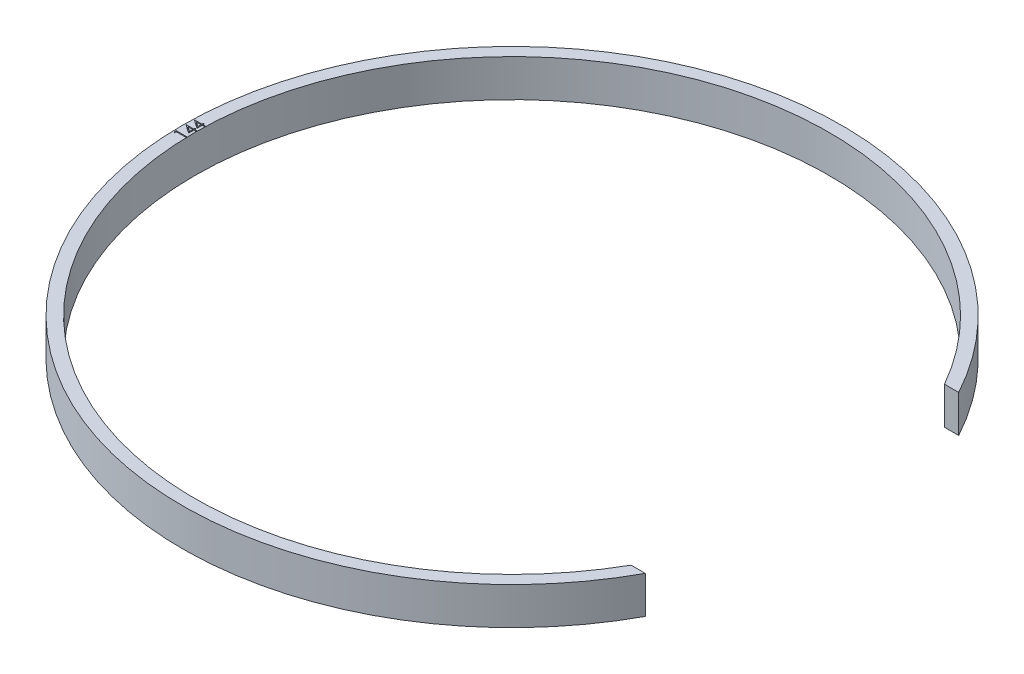
from build123d import *

# Parameters (mm, degrees)
SKETCH1_R           = 53
SKETCH1_R_2         = 51
BOSS_EXTRUDE2_DEPTH = 6
CUT_EXTRUDE1_DEPTH  = 10
CUT_EXTRUDE2_DEPTH  = 0.5


with BuildPart() as part:
    # Sketch1 → Boss-Extrude2 (new body)
    with BuildSketch(Plane(origin=(0, 0, 0), x_dir=(1, 0, 0), z_dir=(0, 1, 0))):
        with Locations(Location((0, 0, 0), (0, 0, 270))):
            Circle(SKETCH1_R)
        with Locations(Location((0, 0, 0), (0, 0, 270))):
            Circle(SKETCH1_R_2, mode=Mode.SUBTRACT)
    extrude(amount=BOSS_EXTRUDE2_DEPTH)

    # Sketch2 → Cut-Extrude1 (cut)
    with BuildSketch(Plane(origin=(0, 6, 0), x_dir=(1, 0, 0), z_dir=(0, 1, 0))):
        Polygon((0, 0), (0, 25.2), (76.826427625, 25.2), (76.826427625, -25.2), (0, -25.2), align=None)
    extrude(amount=-CUT_EXTRUDE1_DEPTH, mode=Mode.SUBTRACT)

    # Sketch3 → Cut-Extrude2 (cut)
    # profile 1 of 3: a face of its own
    with BuildSketch(Plane(origin=(0, 6, 0), x_dir=(1, 0, 0), z_dir=(0, 1, 0))):
        Polygon((-52.794871795, 1.695663061), (-52.794871795, 1.727564103), (-51.583333333, 1.727564103), (-51.583333333, 1.929487179), (-51.403846154, 1.929487179), (-51.403846154, 1.727564103), (-51, 1.727564103), (-51, 1.570512821), (-51.403846154, 1.570512821), (-51.403846154, 0.740384615), align=None)
        Polygon((-51.583333333, 1.570512821), (-52.343349359, 1.570512821), (-51.583333333, 1.048878205), align=None, mode=Mode.SUBTRACT)
    # profile 2 of 3: a face of its own
    with BuildSketch(Plane(origin=(0, 6, 0), x_dir=(1, 0, 0), z_dir=(0, 1, 0))):
        Polygon((-52.794871795, 0.349509215), (-52.794871795, 0.381410256), (-51.583333333, 0.381410256), (-51.583333333, 0.583333333), (-51.403846154, 0.583333333), (-51.403846154, 0.381410256), (-51, 0.381410256), (-51, 0.224358974), (-51.403846154, 0.224358974), (-51.403846154, -0.605769231), align=None)
        Polygon((-51.583333333, 0.224358974), (-52.343349359, 0.224358974), (-51.583333333, -0.297275641), align=None, mode=Mode.SUBTRACT)
    # profile 3 of 3: a face of its own
    with BuildSketch(Plane(origin=(0, 6, 0), x_dir=(1, 0, 0), z_dir=(0, 1, 0))):
        Polygon((-52.75, -1.579977965), (-52.75, -1.256410256), (-51, -1.256410256), (-51, -1.413461538), (-52.570512821, -1.413461538), (-52.570512821, -1.682692308), align=None)
    extrude(amount=-CUT_EXTRUDE2_DEPTH, mode=Mode.SUBTRACT)


solid = part.part
